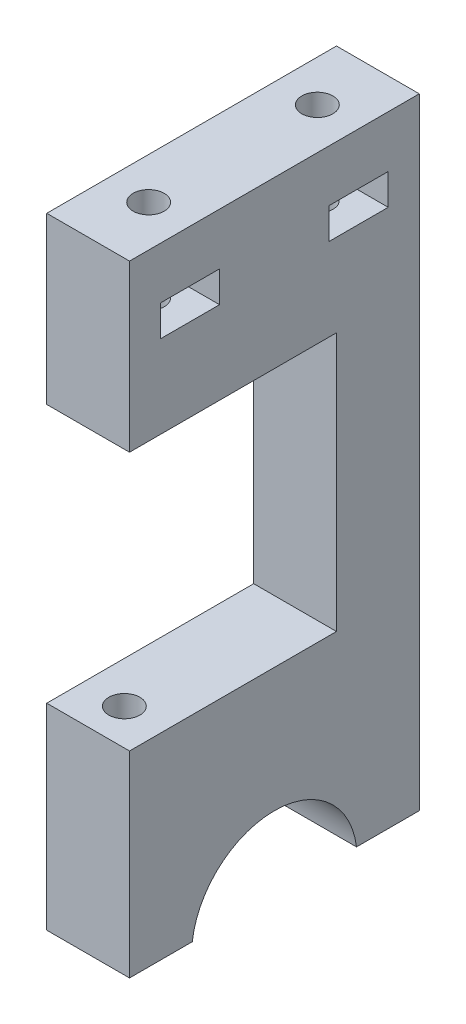
from build123d import *

# Parameters (mm, degrees)
SKETCH1_W           = 8
SKETCH1_H           = 28
BOSS_EXTRUDE2_DEPTH = 60
CUT_EXTRUDE2_DEPTH  = 65.353734654
SKETCH6_R           = 1.5
CUT_EXTRUDE3_DEPTH  = 25
SKETCH7_W           = 5.7
SKETCH7_H           = 3
CUT_EXTRUDE4_DEPTH  = 65.353734654
SKETCH8_R           = 1.5
CUT_EXTRUDE5_DEPTH  = 25
SKETCH9_W           = 20
SKETCH9_H           = 25
CUT_EXTRUDE6_DEPTH  = 65.353734654


with BuildPart() as part:
    # Sketch1 → Boss-Extrude2 (new body)
    with BuildSketch(Plane(origin=(0, 0, 0), x_dir=(1, 0, 0), z_dir=(0, 1, 0))):
        with Locations((6, 7.849557522)):
            Rectangle(SKETCH1_W, SKETCH1_H)
    extrude(amount=BOSS_EXTRUDE2_DEPTH)

    # Sketch5 → Cut-Extrude2 (cut, through all)
    with BuildSketch(Plane(origin=(10, 0, 0), x_dir=(0, 0, -1), z_dir=(1, 0, 0))):
        with BuildLine():
            Line((-0.087696411, 0), (15.786811455, 0))
            ThreePointArc((15.786811455, 0), (7.849557522, 7), (-0.087696411, 0))
        make_face()
    extrude(amount=-CUT_EXTRUDE2_DEPTH, mode=Mode.SUBTRACT)

    # Sketch6 → Cut-Extrude3 (cut)
    with BuildSketch(Plane.XZ):
        with Locations(Location((6, -18.349557522, 0), (0, 0, 270))):
            Circle(SKETCH6_R)
        with Locations(Location((6, 2.650442478, 0), (0, 0, 270))):
            Circle(SKETCH6_R)
    extrude(amount=-CUT_EXTRUDE3_DEPTH, mode=Mode.SUBTRACT)

    # Sketch7 → Cut-Extrude4 (cut, through all)
    with BuildSketch(Plane.ZY.offset(-2)):
        with Locations((-15.999557522, 53.5)):
            Rectangle(SKETCH7_W, SKETCH7_H)
        with Locations((0.300442478, 53.5)):
            Rectangle(SKETCH7_W, SKETCH7_H)
    extrude(amount=-CUT_EXTRUDE4_DEPTH, mode=Mode.SUBTRACT)

    # Sketch8 → Cut-Extrude5 (cut)
    with BuildSketch(Plane(origin=(0, 60, 0), x_dir=(1, 0, 0), z_dir=(0, 1, 0))):
        with Locations(Location((6, 15.999557522, 0), (0, 0, 270))):
            Circle(SKETCH8_R)
        with Locations(Location((6, -0.300442478, 0), (0, 0, 270))):
            Circle(SKETCH8_R)
    extrude(amount=-CUT_EXTRUDE5_DEPTH, mode=Mode.SUBTRACT)

    # Sketch9 → Cut-Extrude6 (cut, through all)
    with BuildSketch(Plane(origin=(10, 0, 0), x_dir=(0, 0, -1), z_dir=(1, 0, 0))):
        with Locations((3.849557522, 31.5)):
            Rectangle(SKETCH9_W, SKETCH9_H)
    extrude(amount=-CUT_EXTRUDE6_DEPTH, mode=Mode.SUBTRACT)


solid = part.part
